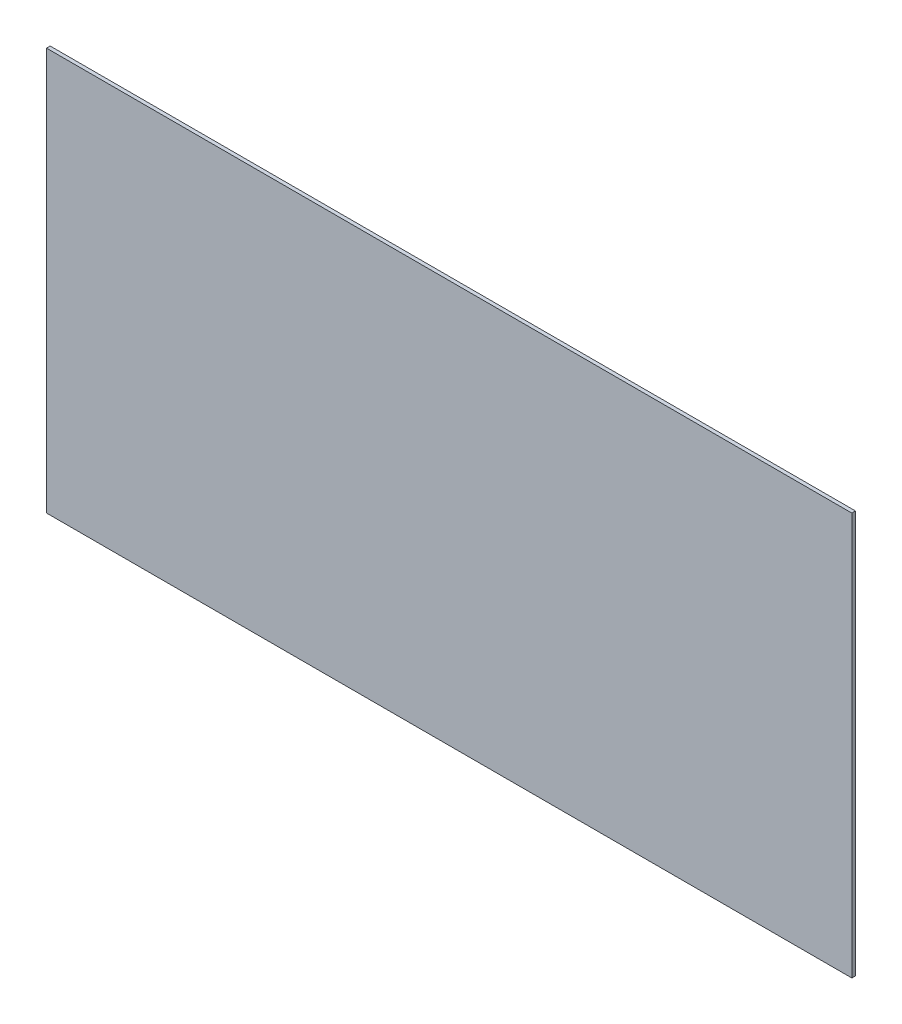
from build123d import *

# Parameters (mm, degrees)
SKETCH1_W           = 2200
SKETCH1_H           = 1100
BOSS_EXTRUDE1_DEPTH = 5


with BuildPart() as part:
    # Sketch1 → Boss-Extrude1 (new, symmetric)
    with BuildSketch(Plane.XY):
        Rectangle(SKETCH1_W, SKETCH1_H)
    extrude(amount=BOSS_EXTRUDE1_DEPTH, both=True)


solid = part.part
